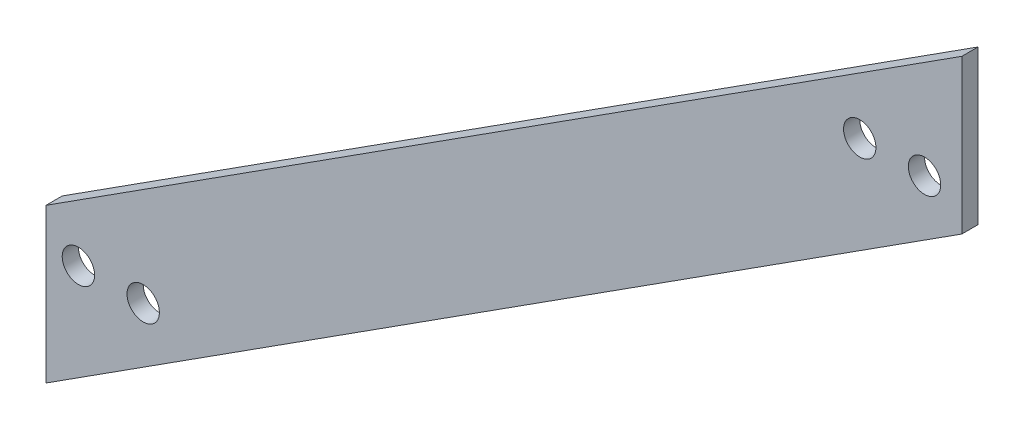
from build123d import *

# Parameters (mm, degrees)
SKETCH1_R           = 4.7625
BOSS_EXTRUDE1_DEPTH = 4.7625


with BuildPart() as part:
    # Sketch1 → Boss-Extrude1 (new body)
    with BuildSketch(Plane.XY):
        Polygon((0, 0), (0, -45.252735849), (269.24, 127.295542021), (269.24, 172.54827787), align=None)
        with Locations(Location((9.525, -10.651818651, 0), (0, 0, 180))):
            Circle(SKETCH1_R, mode=Mode.SUBTRACT)
        with Locations(Location((28.575, -10.651818651, 0), (0, 0, 180))):
            Circle(SKETCH1_R, mode=Mode.SUBTRACT)
        with Locations(Location((239.234787134, 136.668181349, 0), (0, 0, 180))):
            Circle(SKETCH1_R, mode=Mode.SUBTRACT)
        with Locations(Location((258.284787134, 136.668181349, 0), (0, 0, 180))):
            Circle(SKETCH1_R, mode=Mode.SUBTRACT)
    extrude(amount=BOSS_EXTRUDE1_DEPTH)


solid = part.part
